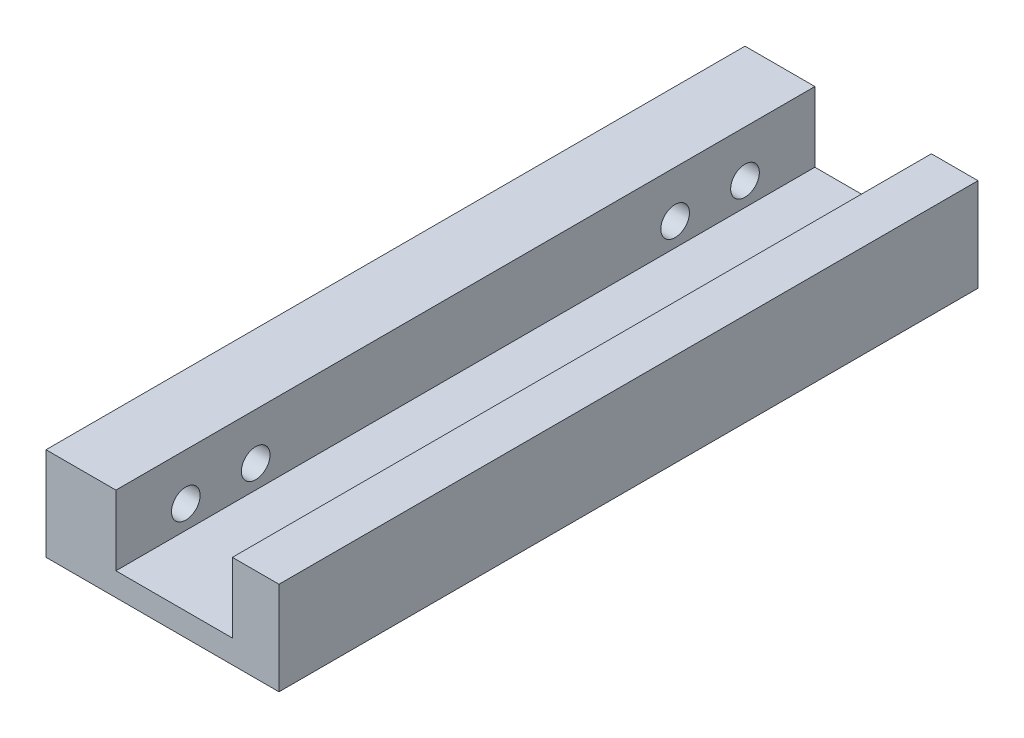
from build123d import *

# Parameters (mm, degrees)
BOSS_EXTRUDE1_DEPTH = 30
SKETCH2_R           = 0.615
CUT_EXTRUDE1_DEPTH  = 3


with BuildPart() as part:
    # Sketch1 → Boss-Extrude1 (new body)
    with BuildSketch(Plane.XY):
        Polygon((0, 0), (3, 0), (3, -3), (8, -3), (8, 0), (10, 0), (10, -4), (0, -4), align=None)
    extrude(amount=BOSS_EXTRUDE1_DEPTH)

    # Sketch2 → Cut-Extrude1 (cut)
    with BuildSketch(Plane.ZY):
        with Locations((3, -2)):
            Circle(SKETCH2_R)
        with Locations((6, -2)):
            Circle(SKETCH2_R)
        with Locations((24, -2)):
            Circle(SKETCH2_R)
        with Locations((27, -2)):
            Circle(SKETCH2_R)
    extrude(amount=-CUT_EXTRUDE1_DEPTH, mode=Mode.SUBTRACT)


solid = part.part
